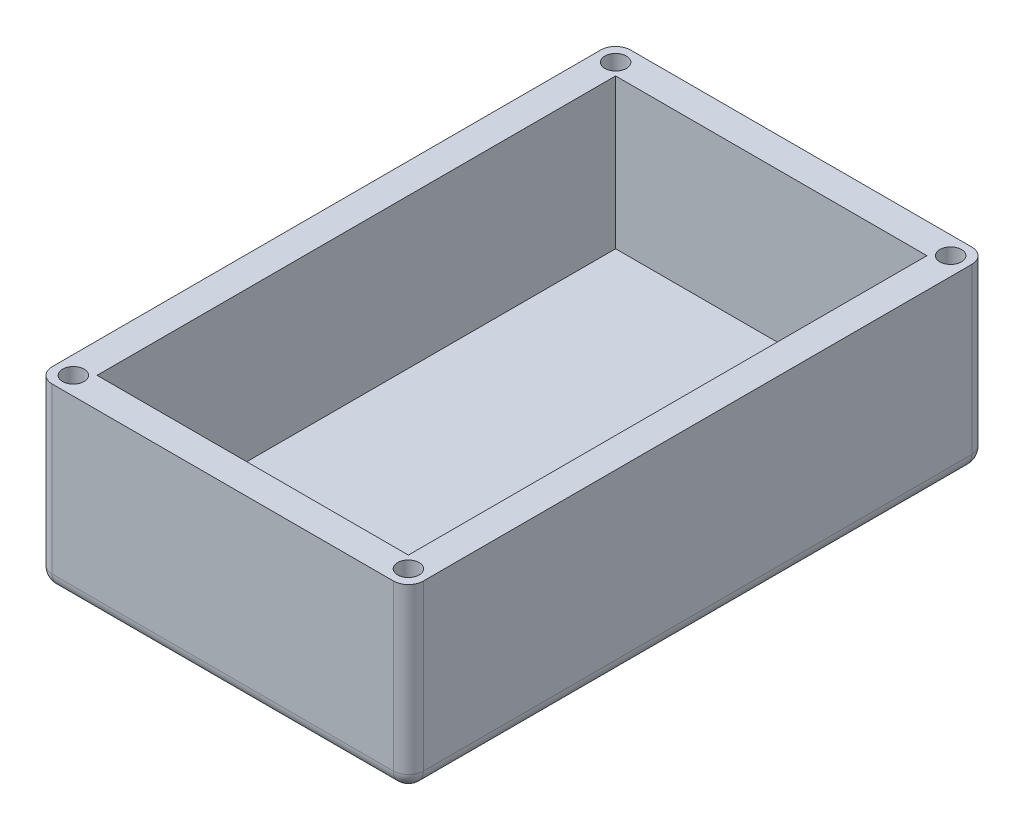
from build123d import *

# Parameters (mm, degrees)
SKETCH1_W          = 33.02
SKETCH1_H          = 55
BASE_DEPTH         = 3.175
SKETCH3_W          = 39.37
SKETCH3_H          = 61.35
SKETCH3_W_2        = 33.02
SKETCH3_H_2        = 55
OUTER_CASING_DEPTH = 19.05
FILLET1_R          = 1.5875
SKETCH5_R          = 1.143
CUT_EXTRUDE5_DEPTH = 6.35


with BuildPart() as part:
    # Sketch1 → Base (new body)
    with BuildSketch(Plane(origin=(0, 0, 0), x_dir=(1, 0, 0), z_dir=(0, 1, 0))):
        Rectangle(SKETCH1_W, SKETCH1_H)
        Polygon((-16.51, 27.5), (16.51, 27.5), (16.51, -27.5), align=None)
    extrude(amount=BASE_DEPTH)

    # Sketch3 → Outer-Casing (add)
    with BuildSketch(Plane.XZ):
        Rectangle(SKETCH3_W, SKETCH3_H)
        Rectangle(SKETCH3_W_2, SKETCH3_H_2, mode=Mode.SUBTRACT)
    extrude(amount=-OUTER_CASING_DEPTH)

    # Fillet1
    fillet1_edges = [part.edges().sort_by_distance(p)[0] for p in [
        (19.685, 9.525, 30.675),
        (19.685, 9.525, -30.675),
        (-19.685, 9.525, -30.675),
        (-19.685, 9.525, 30.675),
        (19.685, 0, 0),
        (0, 0, 30.675),
        (-19.685, 0, 0),
        (0, 0, -30.675),
    ]]
    fillet(fillet1_edges, radius=FILLET1_R)

    # Sketch5 → Cut-Extrude5 (cut)
    with BuildSketch(Plane(origin=(0, 19.05, 0), x_dir=(1, 0, 0), z_dir=(0, 1, 0))):
        with Locations(Location((-17.767235857, 28.757235857, 0), (0, 0, 270))):
            Circle(SKETCH5_R)
        with Locations(Location((-17.767235857, -28.757235857, 0), (0, 0, 270))):
            Circle(SKETCH5_R)
        with Locations(Location((17.767235857, -28.757235857, 0), (0, 0, 270))):
            Circle(SKETCH5_R)
        with Locations(Location((17.767235857, 28.757235857, 0), (0, 0, 270))):
            Circle(SKETCH5_R)
    extrude(amount=-CUT_EXTRUDE5_DEPTH, mode=Mode.SUBTRACT)


solid = part.part
